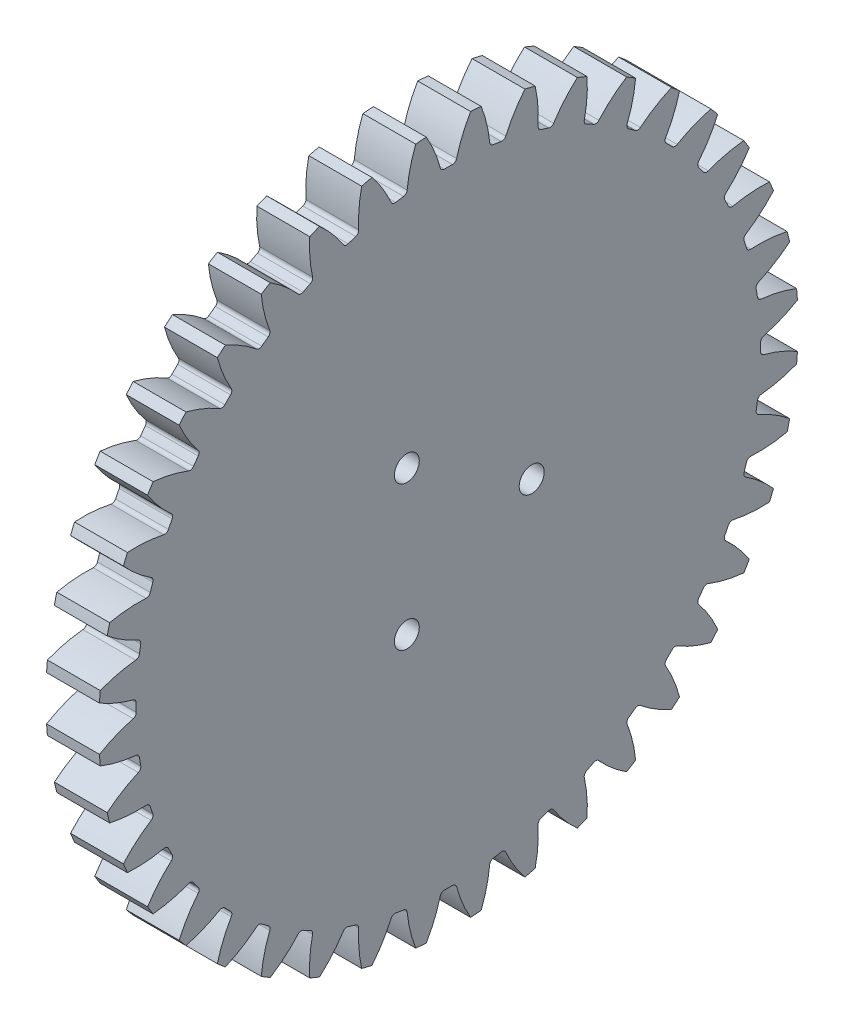
from build123d import *

# Parameters (mm, degrees)
BASPROSKE_W                = 6.35
BASPROSKE_H                = 42
TOOTHCUT_DEPTH             = 60.735437556
ROOTFILLETS_R              = 0.501
TEETHCUTS_COUNT            = 40
TEETHCUTS_ANGLE            = 351
ROOTFILLETS_OF_TEETHCUTS_R = 0.501
SKETCH1_R                  = 1.5
CUT_EXTRUDE1_DEPTH         = 60.61651809


with BuildPart() as part:
    # BasProSke → Base-Revolve (revolve)
    with BuildSketch(Plane(origin=(0, 0, 0), x_dir=(1, 0, 0), z_dir=(0, 1, 0)), mode=Mode.PRIVATE) as base_revolve_sk:
        with Locations((3.175, 21)):
            Rectangle(BASPROSKE_W, BASPROSKE_H)
    revolve(base_revolve_sk.sketch.rotate(Axis((-10, 0, 0), (1, 0, 0)), 180), axis=Axis((-10, 0, 0), (1, 0, 0)))

    # TooCutSke → ToothCut (cut, through all)
    with BuildSketch(Plane(origin=(0, 0, 0), x_dir=(0, 0, -1), z_dir=(1, 0, 0))):
        with BuildLine():
            ThreePointArc((0.882812088, 37.488606854), (0, 37.499), (-0.882812088, 37.488606854))
            ThreePointArc((-0.882812088, 37.488606854), (-1.612748684, 39.782000434), (-2.678427154, 41.939960338))
            ThreePointArc((-2.678427154, 41.939960338), (0, 42.0254), (2.678427154, 41.939960338))
            ThreePointArc((2.678427154, 41.939960338), (1.612748684, 39.782000434), (0.882812088, 37.488606854))
        make_face()
    toothcut = extrude(amount=TOOTHCUT_DEPTH, mode=Mode.SUBTRACT)

    # RootFillets
    rootfillets_edges = [part.edges().sort_by_distance(p)[0] for p in [
        (3.175, 37.488606854, -0.882812088),
        (3.175, 37.488606854, 0.882812088),
    ]]
    fillet(rootfillets_edges, radius=ROOTFILLETS_R)

    # TeethCuts: ToothCut ×40 about axis
    teethcuts_axis = Axis((-10, 0, 0), (1, 0, 0))
    for i in range(1, TEETHCUTS_COUNT):
        add(toothcut.rotate(teethcuts_axis, i * TEETHCUTS_ANGLE / (TEETHCUTS_COUNT - 1)), mode=Mode.SUBTRACT)

    # RootFillets of TeethCuts
    rootfillets_of_teethcuts_edges = [part.edges().sort_by_distance(p)[0] for p in [
        (3.175, 37.165162131, 4.992566952),
        (3.175, 36.888957658, 6.736453364),
        (3.175, 35.926587773, 10.745012425),
        (3.175, 35.380979897, 12.424220802),
        (3.175, 33.80338159, 16.23288003),
        (3.175, 33.001804988, 17.80606269),
        (3.175, 30.847823966, 21.321040256),
        (3.175, 29.810016114, 22.749460219),
        (3.175, 27.132690537, 25.88420571),
        (3.175, 25.88420571, 27.132690537),
        (3.175, 22.749460219, 29.810016114),
        (3.175, 21.321040256, 30.847823966),
        (3.175, 17.80606269, 33.001804988),
        (3.175, 16.23288003, 33.80338159),
        (3.175, 12.424220802, 35.380979897),
        (3.175, 10.745012425, 35.926587773),
        (3.175, 6.736453364, 36.888957658),
        (3.175, 4.992566952, 37.165162131),
        (3.175, 0.882812088, 37.488606854),
        (3.175, -0.882812088, 37.488606854),
        (3.175, -4.992566952, 37.165162131),
        (3.175, -6.736453364, 36.888957658),
        (3.175, -10.745012425, 35.926587773),
        (3.175, -12.424220802, 35.380979897),
        (3.175, -16.23288003, 33.80338159),
        (3.175, -17.80606269, 33.001804988),
        (3.175, -21.321040256, 30.847823966),
        (3.175, -22.749460219, 29.810016114),
        (3.175, -25.88420571, 27.132690537),
        (3.175, -27.132690537, 25.88420571),
        (3.175, -29.810016114, 22.749460219),
        (3.175, -30.847823966, 21.321040256),
        (3.175, -33.001804988, 17.80606269),
        (3.175, -33.80338159, 16.23288003),
        (3.175, -35.380979897, 12.424220802),
        (3.175, -35.926587773, 10.745012425),
        (3.175, -36.888957658, 6.736453364),
        (3.175, -37.165162131, 4.992566952),
        (3.175, -37.488606854, 0.882812088),
        (3.175, -37.488606854, -0.882812088),
        (3.175, -37.165162131, -4.992566952),
        (3.175, -36.888957658, -6.736453364),
        (3.175, -35.926587773, -10.745012425),
        (3.175, -35.380979897, -12.424220802),
        (3.175, -33.80338159, -16.23288003),
        (3.175, -33.001804988, -17.80606269),
        (3.175, -30.847823966, -21.321040256),
        (3.175, -29.810016114, -22.749460219),
        (3.175, -27.132690537, -25.88420571),
        (3.175, -25.88420571, -27.132690537),
        (3.175, -22.749460219, -29.810016114),
        (3.175, -21.321040256, -30.847823966),
        (3.175, -17.80606269, -33.001804988),
        (3.175, -16.23288003, -33.80338159),
        (3.175, -12.424220802, -35.380979897),
        (3.175, -10.745012425, -35.926587773),
        (3.175, -6.736453364, -36.888957658),
        (3.175, -4.992566952, -37.165162131),
        (3.175, -0.882812088, -37.488606854),
        (3.175, 0.882812088, -37.488606854),
        (3.175, 4.992566952, -37.165162131),
        (3.175, 6.736453364, -36.888957658),
        (3.175, 10.745012425, -35.926587773),
        (3.175, 12.424220802, -35.380979897),
        (3.175, 16.23288003, -33.80338159),
        (3.175, 17.80606269, -33.001804988),
        (3.175, 21.321040256, -30.847823966),
        (3.175, 22.749460219, -29.810016114),
        (3.175, 25.88420571, -27.132690537),
        (3.175, 27.132690537, -25.88420571),
        (3.175, 29.810016114, -22.749460219),
        (3.175, 30.847823966, -21.321040256),
        (3.175, 33.001804988, -17.80606269),
        (3.175, 33.80338159, -16.23288003),
        (3.175, 35.380979897, -12.424220802),
        (3.175, 35.926587773, -10.745012425),
        (3.175, 36.888957658, -6.736453364),
        (3.175, 37.165162131, -4.992566952),
    ]]
    fillet(rootfillets_of_teethcuts_edges, radius=ROOTFILLETS_OF_TEETHCUTS_R)

    # Sketch1 → Cut-Extrude1 (cut, through all)
    with BuildSketch(Plane(origin=(6.35, 0, 0), x_dir=(0, 0, -1), z_dir=(1, 0, 0))):
        with Locations((-5, -8.660254038)):
            Circle(SKETCH1_R)
        with Locations((-5, 8.660254038)):
            Circle(SKETCH1_R)
        with Locations((10, 0)):
            Circle(SKETCH1_R)
    extrude(amount=-CUT_EXTRUDE1_DEPTH, mode=Mode.SUBTRACT)


solid = part.part
